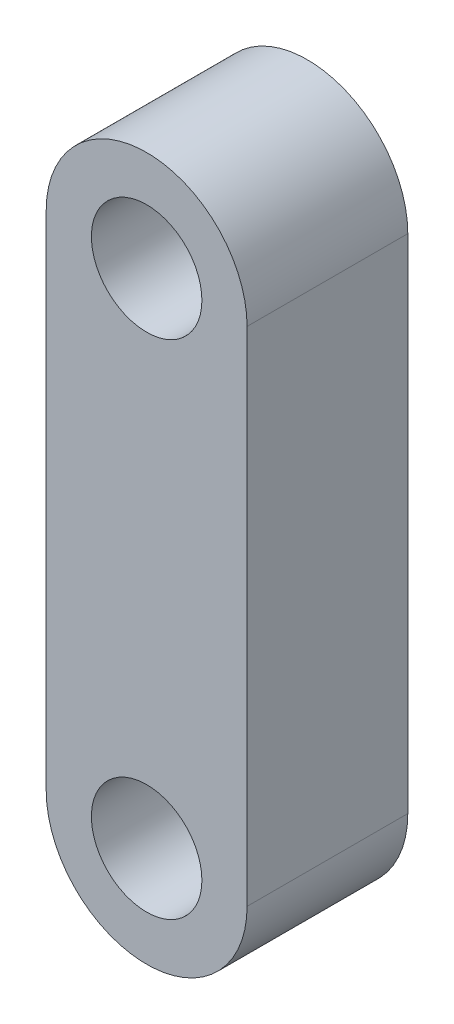
from build123d import *

# Parameters (mm, degrees)
BOSS_EXTRUDE1_DEPTH  = 8
M5_CLEARANCE_HOLE1_D = 5.5


with BuildPart() as part:
    # Sketch1 → Boss-Extrude1 (new body)
    with BuildSketch(Plane.XY):
        with BuildLine():
            Line((-29.24, 12.5), (-29.24, -12.5))
            ThreePointArc((-29.24, -12.5), (-24.24, -17.5), (-19.24, -12.5))
            Line((-19.24, -12.5), (-19.24, 12.5))
            ThreePointArc((-19.24, 12.5), (-24.24, 17.5), (-29.24, 12.5))
        make_face()
    extrude(amount=BOSS_EXTRUDE1_DEPTH)

    # M5 Clearance Hole1 (through all)
    with Locations(Plane.XY.offset(8)):
        with Locations((-24.24, -12.5), (-24.24, 12.5)):
            Hole(M5_CLEARANCE_HOLE1_D / 2)


solid = part.part
